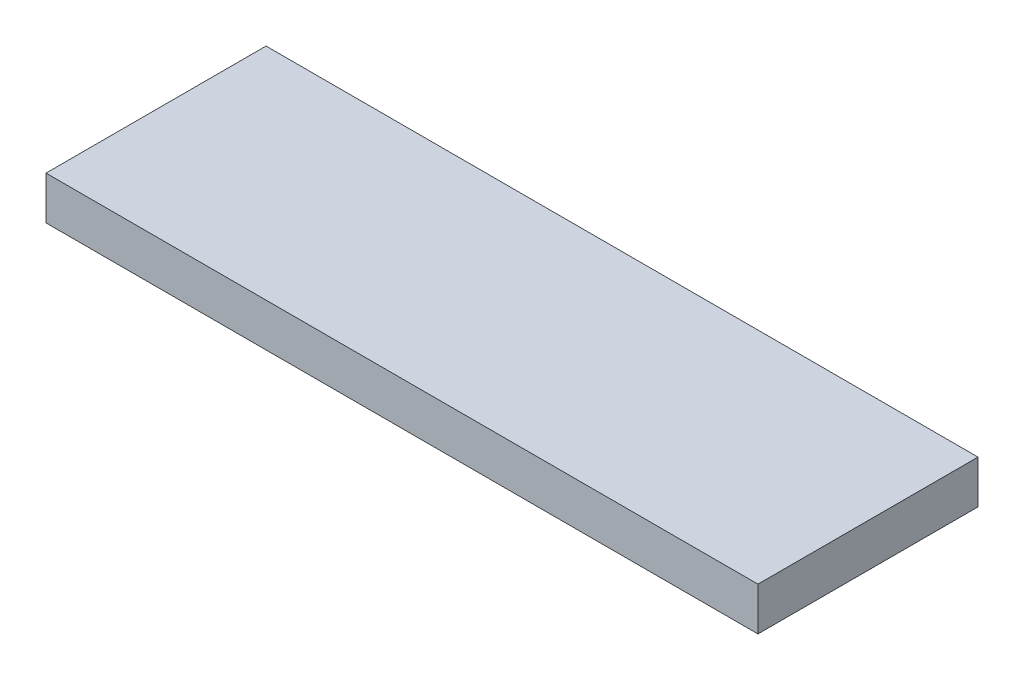
from build123d import *

# Parameters (mm, degrees)
SKETCH1_W           = 66
SKETCH1_H           = 20.4
BOSS_EXTRUDE1_DEPTH = 2


with BuildPart() as part:
    # Sketch1 → Boss-Extrude1 (new, symmetric)
    with BuildSketch(Plane(origin=(0, 0, 0), x_dir=(1, 0, 0), z_dir=(0, 1, 0))):
        with Locations((-22.182290307, -30.870572577)):
            Rectangle(SKETCH1_W, SKETCH1_H)
    extrude(amount=BOSS_EXTRUDE1_DEPTH, both=True)


solid = part.part
